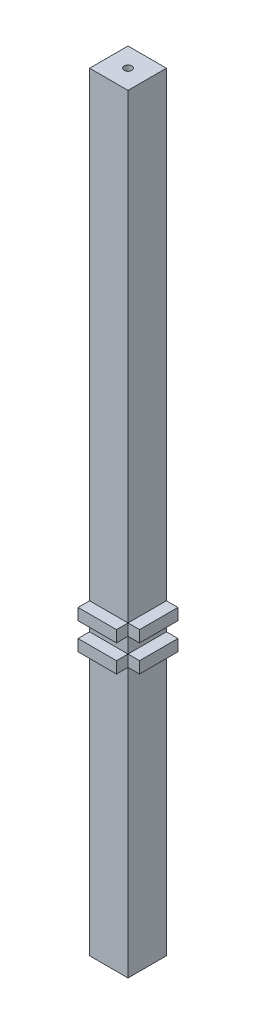
from build123d import *

# Parameters (mm, degrees)
SZKIC1_W                    = 10
SZKIC1_H                    = 10
DODANIE_WYCI_GNI_CIE1_DEPTH = 200
SZKIC2_R                    = 1
WYTNIJ_WYCI_GNI_CIE1_DEPTH  = 10
WYTNIJ_WYCI_GNI_CIE2_START  = -10
SZKIC3_R                    = 1
WYTNIJ_WYCI_GNI_CIE2_DEPTH  = 10
SZKIC4_W                    = 10
SZKIC4_H                    = 3
DODANIE_WYCI_GNI_CIE2_DEPTH = 3
SZKIC6_W                    = 10
SZKIC6_H                    = 3
DODANIE_WYCI_GNI_CIE3_DEPTH = 3


with BuildPart() as part:
    # Szkic1 → Dodanie-wyciągnięcie1 (new body)
    with BuildSketch(Plane(origin=(0, 0, 0), x_dir=(1, 0, 0), z_dir=(0, 1, 0))):
        Rectangle(SZKIC1_W, SZKIC1_H)
    extrude(amount=DODANIE_WYCI_GNI_CIE1_DEPTH)

    # Szkic2 → Wytnij-wyciągnięcie1 (cut)
    with BuildSketch(Plane(origin=(0, 200, 0), x_dir=(1, 0, 0), z_dir=(0, 1, 0))):
        with Locations(Location((0, 0, 0), (0, 0, 270))):
            Circle(SZKIC2_R)
    extrude(amount=-WYTNIJ_WYCI_GNI_CIE1_DEPTH, mode=Mode.SUBTRACT)

    # Szkic3 → Wytnij-wyciągnięcie2 (cut)
    with BuildSketch(Plane.XZ.offset(WYTNIJ_WYCI_GNI_CIE2_START)):
        with Locations(Location((0, 0, 0), (0, 0, 90))):
            Circle(SZKIC3_R)
    extrude(amount=WYTNIJ_WYCI_GNI_CIE2_DEPTH, mode=Mode.SUBTRACT)

    # Szkic4 → Dodanie-wyciągnięcie2 (add)
    with BuildSketch(Plane.XY.offset(5)):
        with Locations((0, 71.5)):
            Rectangle(SZKIC4_W, SZKIC4_H)
        with Locations((0, 78.5)):
            Rectangle(SZKIC4_W, SZKIC4_H)
    extrude(amount=DODANIE_WYCI_GNI_CIE2_DEPTH)

    # Szkic6 → Dodanie-wyciągnięcie3 (add)
    with BuildSketch(Plane(origin=(5, 0, 0), x_dir=(0, 0, -1), z_dir=(1, 0, 0))):
        with Locations((0, 71.5)):
            Rectangle(SZKIC6_W, SZKIC6_H)
        with Locations((0, 78.5)):
            Rectangle(SZKIC6_W, SZKIC6_H)
    extrude(amount=DODANIE_WYCI_GNI_CIE3_DEPTH)


solid = part.part
